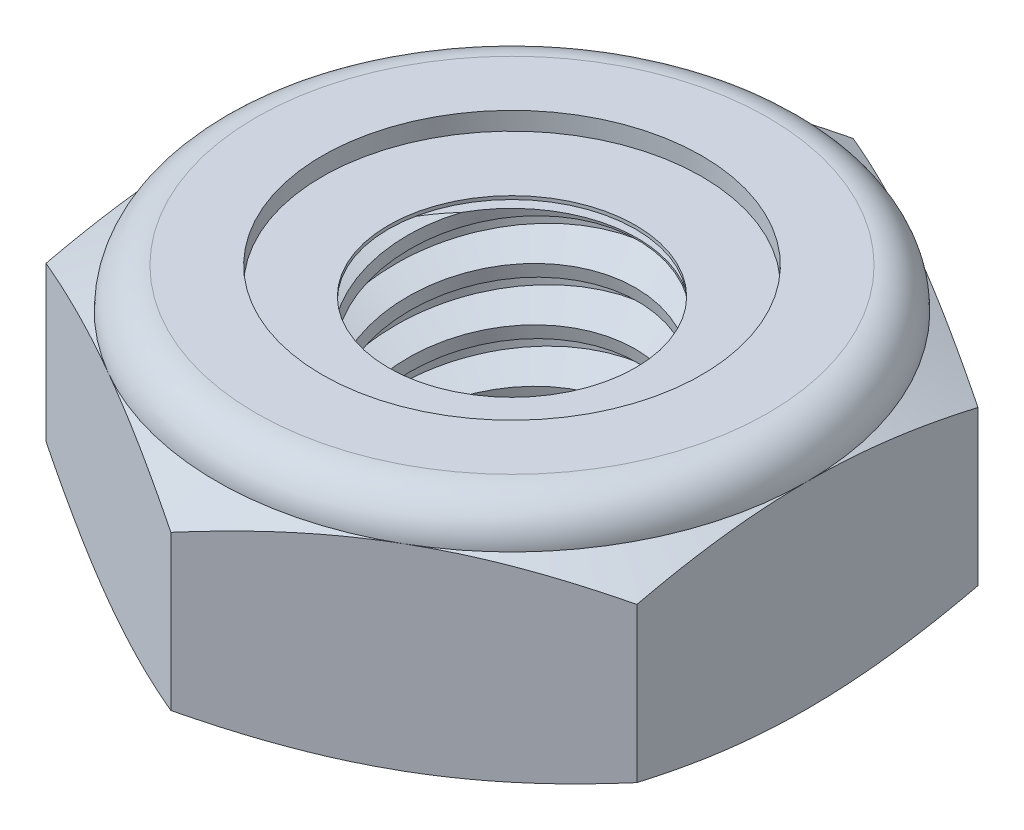
from build123d import *

# Parameters (mm, degrees)
EXTRUDE1_DEPTH      = 2
SKETCH2_W           = 1.25
SKETCH2_H           = 2
LPATTERN1_COUNT     = 4
LPATTERN1_PITCH     = 0.45
LPATTERN1_COL_COUNT = 2
LPATTERN1_COL_PITCH = 0.45


with BuildPart() as part:
    # Sketch1 → Extrude1 (new body)
    with BuildSketch(Plane(origin=(0, 0, 0), x_dir=(1, 0, 0), z_dir=(0, 1, 0))):
        Polygon((0, 2.886751346), (-2.5, 1.443375673), (-2.5, -1.443375673), (0, -2.886751346), (2.5, -1.443375673), (2.5, 1.443375673), align=None)
    extrude(amount=EXTRUDE1_DEPTH)

    # Sketch4 → Cut-Revolve2 (revolve, cut)
    with BuildSketch(Plane(origin=(0, 0, 0), x_dir=(0, 0, -1), z_dir=(1, 0, 0))):
        Polygon((0, 2), (1.25, 2), (1.045159814, 1.904481453), (1.045159814, 0.095518547), (1.25, 0), (0, 0), align=None)
    revolve(axis=Axis((0, 2, 0), (0, 1, 0)), mode=Mode.SUBTRACT)


with BuildPart() as body_2:
    # Sketch2 → Revolve1 (revolve)
    with BuildSketch(Plane(origin=(0, 0, 0), x_dir=(0, 0, -1), z_dir=(1, 0, 0))):
        with Locations((0.625, 1)):
            Rectangle(SKETCH2_W, SKETCH2_H)
    revolve(axis=Axis((0, -1.25, 0), (0, 1, 0)))

    # Sketch3 → Cut-Revolve1 (revolve, cut)
    with BuildSketch(Plane(origin=(0, 0, 0), x_dir=(0, 0, -1), z_dir=(1, 0, 0)), mode=Mode.PRIVATE) as cut_revolve1_sk:
        Polygon((1.259964856, 1.944639688), (1.329718849, 1.557117504), (1.065089526, 1.652369191), (1.045159814, 1.763089815), align=None)
    cut_revolve1 = revolve(cut_revolve1_sk.sketch.rotate(Axis((0, 2, 0.086794729), (0, -0.9841833239736953, -0.17715299831526504)), 180), axis=Axis((0, 2, 0.086794729), (0, -0.9841833239736953, -0.17715299831526504)), mode=Mode.SUBTRACT)

    # LPattern1: Cut-Revolve1 ×4
    with Locations(*[(0, -i * LPATTERN1_PITCH, 0) for i in range(1, LPATTERN1_COUNT)]):
        add(cut_revolve1, mode=Mode.SUBTRACT)

    # LPattern1 col: Cut-Revolve1 ×2
    with Locations(*[(0, i * LPATTERN1_COL_PITCH, 0) for i in range(1, LPATTERN1_COL_COUNT)]):
        add(cut_revolve1, mode=Mode.SUBTRACT)


with BuildPart() as part_1:
    add(part.part)

    # Combine1: cut body 2
    add(body_2.part, mode=Mode.SUBTRACT)

    # Sketch5 → Cut-Revolve3 (revolve, cut)
    with BuildSketch(Plane(origin=(0, 0, 0), x_dir=(0, 0, -1), z_dir=(1, 0, 0)), mode=Mode.PRIVATE) as cut_revolve3_sk:
        with BuildLine():
            Line((0, 0), (2.5, 0))
            Line((2.5, 0), (2.886751346, 0.180345114))
            Line((2.886751346, 0.180345114), (2.886751346, 1.486321552))
            Line((2.886751346, 1.486321552), (2.5, 1.666666667))
            ThreePointArc((2.5, 1.666666667), (2.402368927, 1.902368927), (2.166666667, 2))
            Line((2.166666667, 2), (2.166666667, 3.27))
            Line((2.166666667, 3.27), (4.156751346, 3.27))
            Line((4.156751346, 3.27), (4.156751346, -1.27))
            Line((4.156751346, -1.27), (0, -1.27))
            Line((0, -1.27), (0, 0))
        make_face()
    revolve(cut_revolve3_sk.sketch.rotate(Axis((0, 0, 0), (0, 1, 0)), 54.614775388), axis=Axis((0, 0, 0), (0, 1, 0)), mode=Mode.SUBTRACT)

    # Sketch6 → Cut-Revolve4 (revolve, cut)
    with BuildSketch(Plane(origin=(0, 0, 0), x_dir=(0, 0, -1), z_dir=(1, 0, 0))):
        with BuildLine():
            Line((0, 1.666666667), (2.3476, 1.666666667))
            ThreePointArc((2.3476, 1.666666667), (2.294605854, 1.794605854), (2.166666667, 1.8476))
            Line((2.166666667, 1.8476), (1.60591324, 1.8476))
            Line((1.60591324, 1.8476), (1.60591324, 3.27))
            Line((1.60591324, 3.27), (0, 3.27))
            Line((0, 3.27), (0, 1.666666667))
        make_face()
    revolve(axis=Axis((0, 3.27, 0), (0, 1, 0)), mode=Mode.SUBTRACT)


with BuildPart() as body_2_2:
    # Sketch7 → Revolve2 (revolve)
    with BuildSketch(Plane(origin=(0, 0, 0), x_dir=(0, 0, -1), z_dir=(1, 0, 0))):
        with BuildLine():
            Line((1.045159814, 1.742866667), (2.238518118, 1.742866667))
            ThreePointArc((2.238518118, 1.742866667), (2.205321492, 1.764005639), (2.166666667, 1.7714))
            Line((2.166666667, 1.7714), (1.045159814, 1.7714))
            Line((1.045159814, 1.7714), (1.045159814, 1.742866667))
        make_face()
    revolve(axis=Axis((0, 1.742866667, 0), (0, 1, 0)))


solid = Compound([part_1.part, body_2_2.part])
